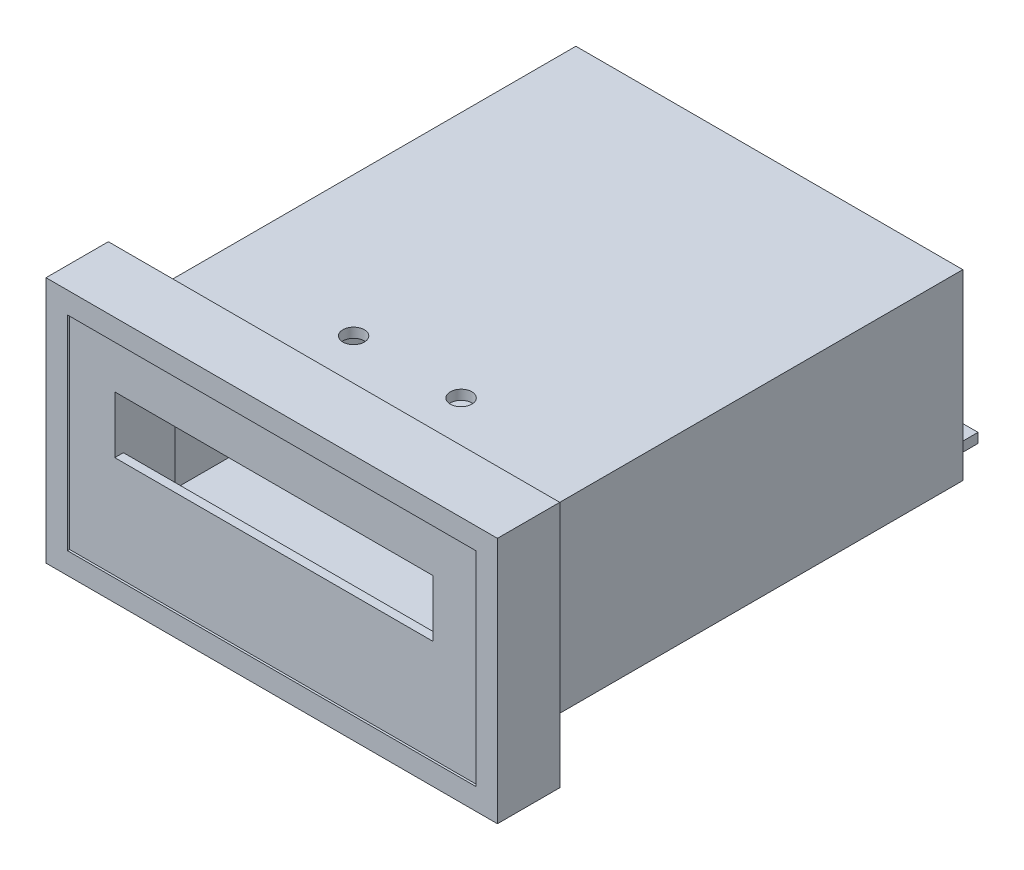
from build123d import *

# Parameters (mm, degrees)
SKETCH1_W           = 106.68
SKETCH1_H           = 58.42
BOSS_EXTRUDE1_DEPTH = 14.732
SKETCH2_W           = 96.52
SKETCH2_H           = 48.26
CUT_EXTRUDE1_DEPTH  = 0.508
SKETCH3_W           = 75.184
SKETCH3_H           = 26.924
CUT_EXTRUDE2_DEPTH  = 12.192
SKETCH4_W           = 75.184
SKETCH4_H           = 13.462
CUT_EXTRUDE3_DEPTH  = 12.192
SKETCH5_W           = 96.52
SKETCH5_H           = 48.26
SKETCH5_W_2         = 91.44
SKETCH5_H_2         = 43.18
BOSS_EXTRUDE2_DEPTH = 3.81
SKETCH6_W           = 91.44
SKETCH6_H           = 43.18
SKETCH6_W_2         = 86.868
SKETCH6_H_2         = 38.608
BOSS_EXTRUDE3_DEPTH = 99.06
SKETCH7_W           = 86.868
SKETCH7_H           = 10.16
BOSS_EXTRUDE4_DEPTH = 2.54
SKETCH8_W           = 78.274407713
SKETCH8_H           = 9.388134975
BOSS_EXTRUDE5_DEPTH = 2.286
SKETCH9_R           = 2.54
CUT_EXTRUDE4_DEPTH  = 2.286


with BuildPart() as part:
    # Sketch1 → Boss-Extrude1 (new body)
    with BuildSketch(Plane.XY):
        Rectangle(SKETCH1_W, SKETCH1_H)
    extrude(amount=-BOSS_EXTRUDE1_DEPTH)

    # Sketch2 → Cut-Extrude1 (cut)
    with BuildSketch(Plane.XY):
        Rectangle(SKETCH2_W, SKETCH2_H)
    extrude(amount=-CUT_EXTRUDE1_DEPTH, mode=Mode.SUBTRACT)

    # Sketch3 → Cut-Extrude2 (cut)
    with BuildSketch(Plane(origin=(0, 0, -14.732), x_dir=(-1, 0, 0), z_dir=(0, 0, -1))):
        Rectangle(SKETCH3_W, SKETCH3_H)
    extrude(amount=-CUT_EXTRUDE2_DEPTH, mode=Mode.SUBTRACT)

    # Sketch4 → Cut-Extrude3 (cut)
    with BuildSketch(Plane(origin=(0, 0, -2.54), x_dir=(-1, 0, 0), z_dir=(0, 0, -1))):
        with Locations((0, 6.731)):
            Rectangle(SKETCH4_W, SKETCH4_H)
    extrude(amount=-CUT_EXTRUDE3_DEPTH, mode=Mode.SUBTRACT)

    # Sketch5 → Boss-Extrude2 (add)
    with BuildSketch(Plane(origin=(0, 0, -14.732), x_dir=(-1, 0, 0), z_dir=(0, 0, -1))):
        Rectangle(SKETCH5_W, SKETCH5_H)
        Rectangle(SKETCH5_W_2, SKETCH5_H_2, mode=Mode.SUBTRACT)
    extrude(amount=BOSS_EXTRUDE2_DEPTH)


with BuildPart() as body_2:
    # Sketch6 → Boss-Extrude3 (new body)
    with BuildSketch(Plane(origin=(0, 0, -18.542), x_dir=(-1, 0, 0), z_dir=(0, 0, -1))):
        Rectangle(SKETCH6_W, SKETCH6_H)
        Rectangle(SKETCH6_W_2, SKETCH6_H_2, mode=Mode.SUBTRACT)
    extrude(amount=BOSS_EXTRUDE3_DEPTH)

    # Sketch7 → Boss-Extrude4 (add)
    with BuildSketch(Plane(origin=(0, 0, -117.602), x_dir=(-1, 0, 0), z_dir=(0, 0, -1))):
        Rectangle(SKETCH7_W, SKETCH7_H)
    extrude(amount=-BOSS_EXTRUDE4_DEPTH)

    # Sketch8 → Boss-Extrude5 (add)
    with BuildSketch(Plane(origin=(0, -19.304, 0), x_dir=(1, 0, 0), z_dir=(0, 1, 0))):
        with Locations((0.783203857, 122.296067488)):
            Rectangle(SKETCH8_W, SKETCH8_H)
    extrude(amount=-BOSS_EXTRUDE5_DEPTH)

    # Sketch9 → Cut-Extrude4 (cut)
    with BuildSketch(Plane(origin=(0, 21.59, 0), x_dir=(1, 0, 0), z_dir=(0, 1, 0))):
        with Locations(Location((12.7, 32.0548, 0), (0, 0, 270))):
            Circle(SKETCH9_R)
        with Locations(Location((-12.7, 32.0548, 0), (0, 0, 270))):
            Circle(SKETCH9_R)
    extrude(amount=-CUT_EXTRUDE4_DEPTH, mode=Mode.SUBTRACT)


solid = Compound([part.part, body_2.part])
